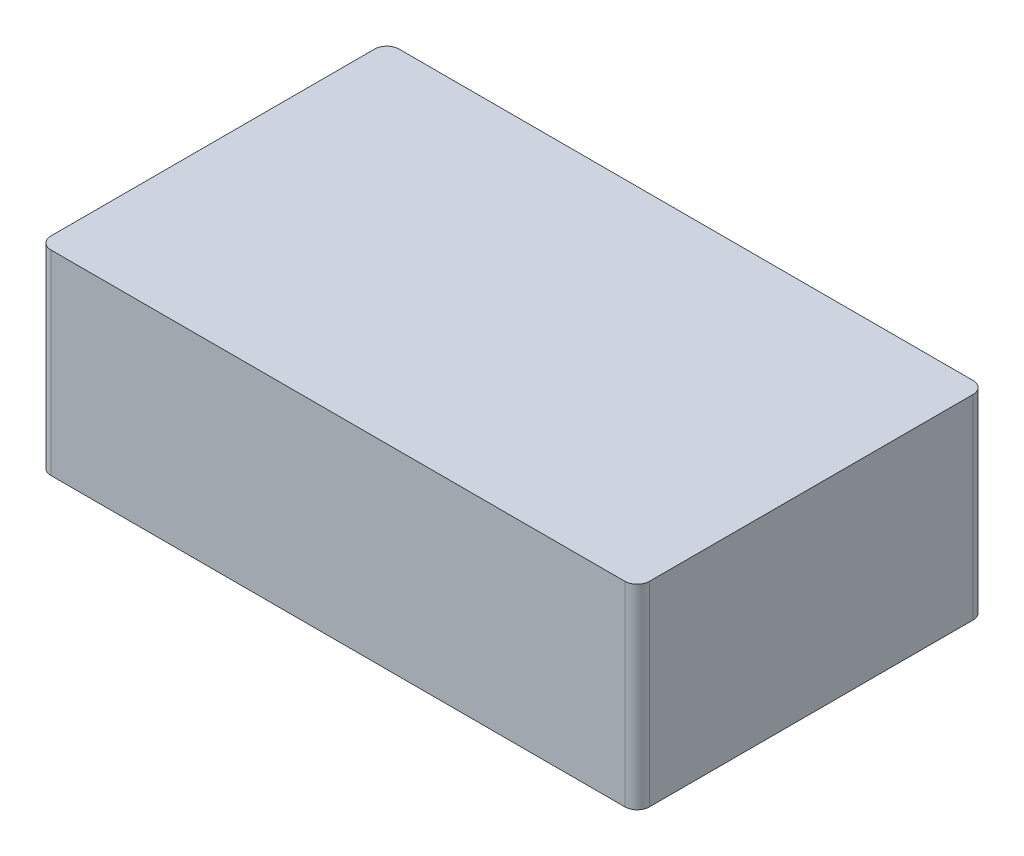
from build123d import *

# Parameters (mm, degrees)
SKETCH1_W           = 49
SKETCH1_H           = 28.5
BOSS_EXTRUDE1_DEPTH = 16
FILLET1_R           = 1


with BuildPart() as part:
    # Sketch1 → Boss-Extrude1 (new body)
    with BuildSketch(Plane(origin=(0, 0, 0), x_dir=(1, 0, 0), z_dir=(0, 1, 0))):
        Rectangle(SKETCH1_W, SKETCH1_H)
    extrude(amount=BOSS_EXTRUDE1_DEPTH)

    # Fillet1
    fillet1_edges = [part.edges().sort_by_distance(p)[0] for p in [
        (24.5, 8, 14.25),
        (-24.5, 8, 14.25),
        (-24.5, 8, -14.25),
        (24.5, 8, -14.25),
    ]]
    fillet(fillet1_edges, radius=FILLET1_R)


solid = part.part
